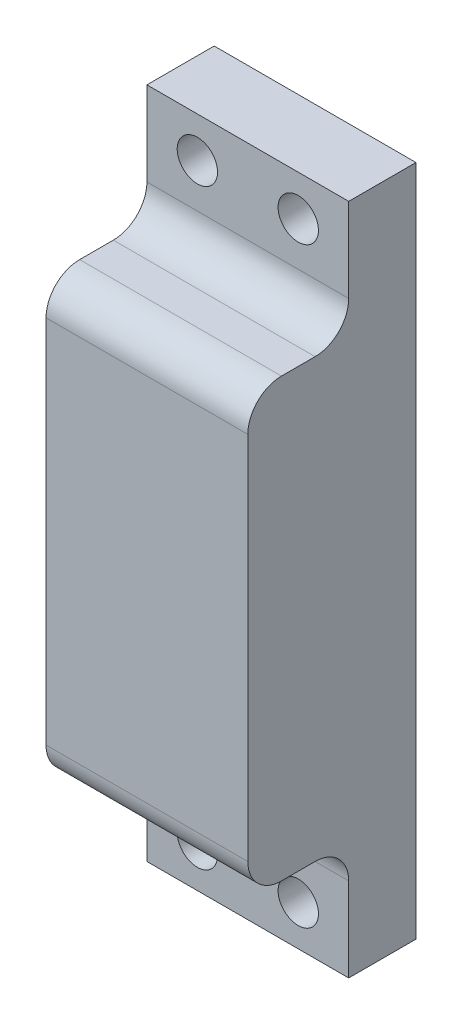
from build123d import *

# Parameters (mm, degrees)
BOSS_EXTRUDE1_DEPTH                      = 60
CBORE_FOR_M10_HEX_HEAD_BOLT1_D           = 8
CBORE_FOR_M10_HEX_HEAD_BOLT1_CBORE_D     = 12
CBORE_FOR_M10_HEX_HEAD_BOLT1_CBORE_DEPTH = 10


with BuildPart() as part:
    # Sketch1 → Boss-Extrude1 (new body)
    with BuildSketch(Plane.YZ):
        with BuildLine():
            Line((-100, 0), (100, 0))
            Line((100, 0), (100, 20))
            Line((100, 20), (75, 20))
            ThreePointArc((75, 20), (67.928932188, 22.928932188), (65, 30))
            Line((65, 30), (65, 40))
            ThreePointArc((65, 40), (62.071067812, 47.071067812), (55, 50))
            Line((55, 50), (-55, 50))
            ThreePointArc((-55, 50), (-62.071067812, 47.071067812), (-65, 40))
            Line((-65, 40), (-65, 30))
            ThreePointArc((-65, 30), (-67.928932188, 22.928932188), (-75, 20))
            Line((-75, 20), (-100, 20))
            Line((-100, 20), (-100, 0))
        make_face()
    extrude(amount=-BOSS_EXTRUDE1_DEPTH)

    # CBORE for M10 Hex Head Bolt1 (through all)
    with Locations(Plane.XY.offset(20)):
        with Locations((-15, -88), (-45, -88), (-45, 88), (-15, 88)):
            CounterBoreHole(CBORE_FOR_M10_HEX_HEAD_BOLT1_D / 2, CBORE_FOR_M10_HEX_HEAD_BOLT1_CBORE_D / 2, CBORE_FOR_M10_HEX_HEAD_BOLT1_CBORE_DEPTH)


solid = part.part
